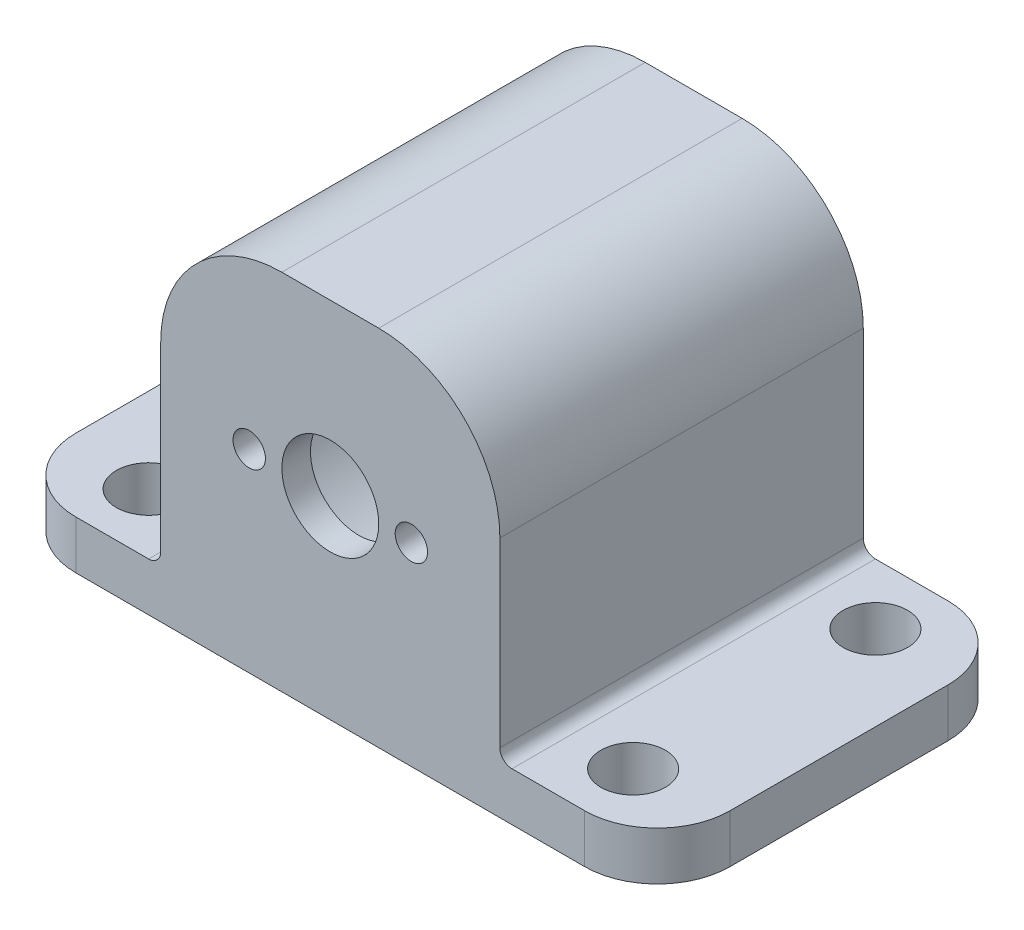
from build123d import *

# Parameters (mm, degrees)
SKETCH1_R               = 14.224
BOSS_EXTRUDE1_DEPTH     = 38.1
F_1_4_CLEARANCE_HOLE1_D = 6.7564
SKETCH4_R               = 16.637181665
SKETCH4_R_2             = 5.08
SKETCH4_R_3             = 1.7
BOSS_EXTRUDE2_DEPTH     = 3
FILLET1_R               = 7.62
CHAMFER1_SIZE           = 1.27


with BuildPart() as part:
    # Sketch1 → Boss-Extrude1 (new body)
    with BuildSketch(Plane.XY):
        with BuildLine():
            Line((-34.29, 0), (34.29, 0))
            Line((34.29, 0), (34.29, 5.08))
            Line((34.29, 5.08), (19.05, 5.08))
            ThreePointArc((19.05, 5.08), (18.151974388, 5.451974388), (17.78, 6.35))
            Line((17.78, 6.35), (17.78, 20.32))
            Line((17.78, 20.32), (17.78, 25.4))
            ThreePointArc((17.78, 25.4), (14.060256121, 34.380256121), (5.08, 38.1))
            Line((5.08, 38.1), (-5.08, 38.1))
            ThreePointArc((-5.08, 38.1), (-14.060256121, 34.380256121), (-17.78, 25.4))
            Line((-17.78, 25.4), (-17.78, 20.32))
            Line((-17.78, 20.32), (-17.78, 6.35))
            ThreePointArc((-17.78, 6.35), (-18.151974388, 5.451974388), (-19.05, 5.08))
            Line((-19.05, 5.08), (-34.29, 5.08))
            Line((-34.29, 5.08), (-34.29, 0))
        make_face()
        with Locations(Location((0, 20.32, 0), (0, 0, 180))):
            Circle(SKETCH1_R, mode=Mode.SUBTRACT)
    extrude(amount=BOSS_EXTRUDE1_DEPTH)

    # 1/4 Clearance Hole1 (through all)
    with Locations(Plane(origin=(0, 5.08, 0), x_dir=(1, 0, 0), z_dir=(0, 1, 0))):
        with Locations((-25.4, -6.35), (25.4, -31.75), (-25.4, -31.75), (25.4, -6.35)):
            Hole(F_1_4_CLEARANCE_HOLE1_D / 2)

    # Sketch4 → Boss-Extrude2 (add)
    with BuildSketch(Plane.XY.offset(38.1)):
        with Locations((0, 20.32)):
            Circle(SKETCH4_R)
        with Locations((0, 20.32)):
            Circle(SKETCH4_R_2, mode=Mode.SUBTRACT)
        with Locations((8.5, 20.32)):
            Circle(SKETCH4_R_3, mode=Mode.SUBTRACT)
        with Locations((-8.5, 20.32)):
            Circle(SKETCH4_R_3, mode=Mode.SUBTRACT)
    extrude(amount=-BOSS_EXTRUDE2_DEPTH)

    # Fillet1
    fillet1_edges = [part.edges().sort_by_distance(p)[0] for p in [
        (-34.29, 2.54, 0),
        (34.29, 2.54, 0),
        (34.29, 2.54, 38.1),
        (-34.29, 2.54, 38.1),
    ]]
    fillet(fillet1_edges, radius=FILLET1_R)

    # Chamfer1
    chamfer1_edges = [part.edges().sort_by_distance(p)[0] for p in [
        (14.224, 20.32, 0),
    ]]
    chamfer(chamfer1_edges, length=CHAMFER1_SIZE)


solid = part.part
